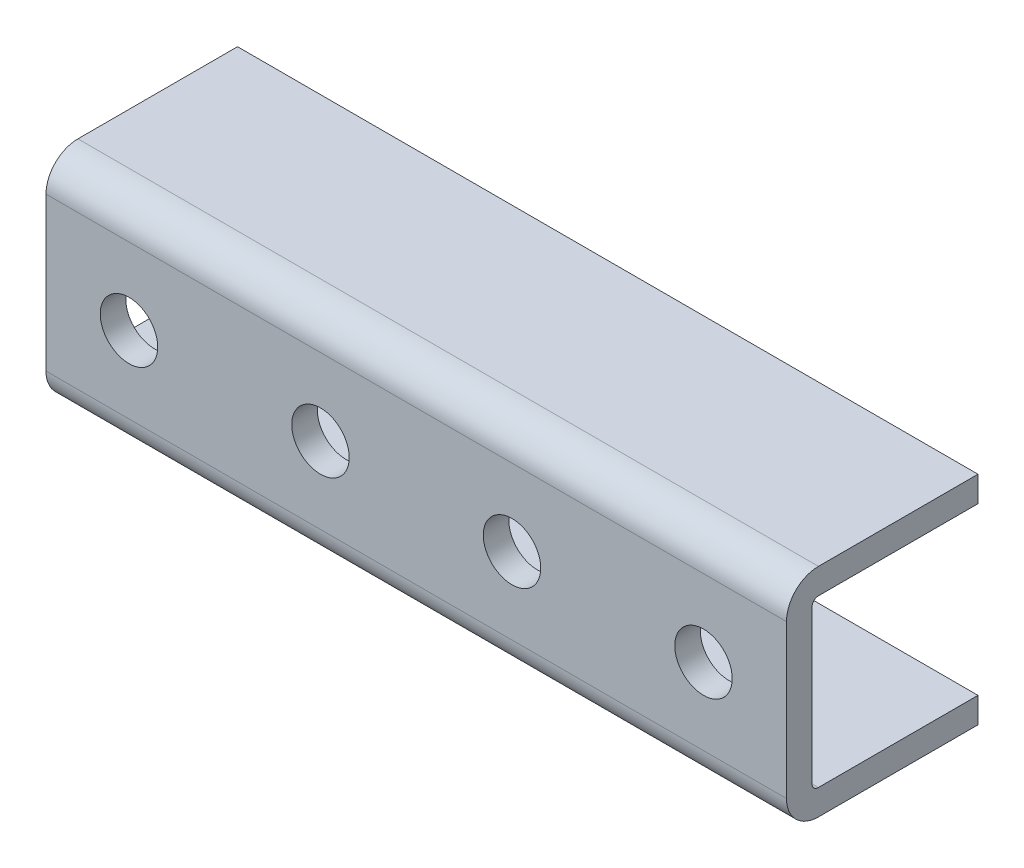
from build123d import *

# Parameters (mm, degrees)
SKETCH1_W           = 184.15
SKETCH1_H           = 53.975
BOSS_EXTRUDE1_DEPTH = 23.8125
FILLET1_R           = 7.9375
SHELL1_T            = -6.35
SKETCH2_R           = 7.14375
CUT_EXTRUDE1_DEPTH  = 47.625


with BuildPart() as part:
    # Sketch1 → Boss-Extrude1 (new, symmetric)
    with BuildSketch(Plane.XY):
        Rectangle(SKETCH1_W, SKETCH1_H)
    extrude(amount=BOSS_EXTRUDE1_DEPTH, both=True)

    # Fillet1
    fillet1_edges = [part.edges().sort_by_distance(p)[0] for p in [
        (0, 26.9875, 23.8125),
        (0, -26.9875, 23.8125),
    ]]
    fillet(fillet1_edges, radius=FILLET1_R)

    # Shell1
    shell1_openings = [part.faces().sort_by_distance(p)[0] for p in [
        (0, 0, -23.8125),
        (92.075, 0, -0.234313972),
        (-92.075, 0, -0.234313972),
    ]]
    offset(amount=SHELL1_T, openings=shell1_openings, kind=Kind.INTERSECTION)

    # Sketch2 → Cut-Extrude1 (cut)
    with BuildSketch(Plane.XY.offset(23.8125)):
        with Locations((-71.4375, 0)):
            Circle(SKETCH2_R)
        with Locations((-23.8125, 0)):
            Circle(SKETCH2_R)
        with Locations((23.8125, 0)):
            Circle(SKETCH2_R)
        with Locations((71.4375, 0)):
            Circle(SKETCH2_R)
    extrude(amount=-CUT_EXTRUDE1_DEPTH, mode=Mode.SUBTRACT)


solid = part.part
